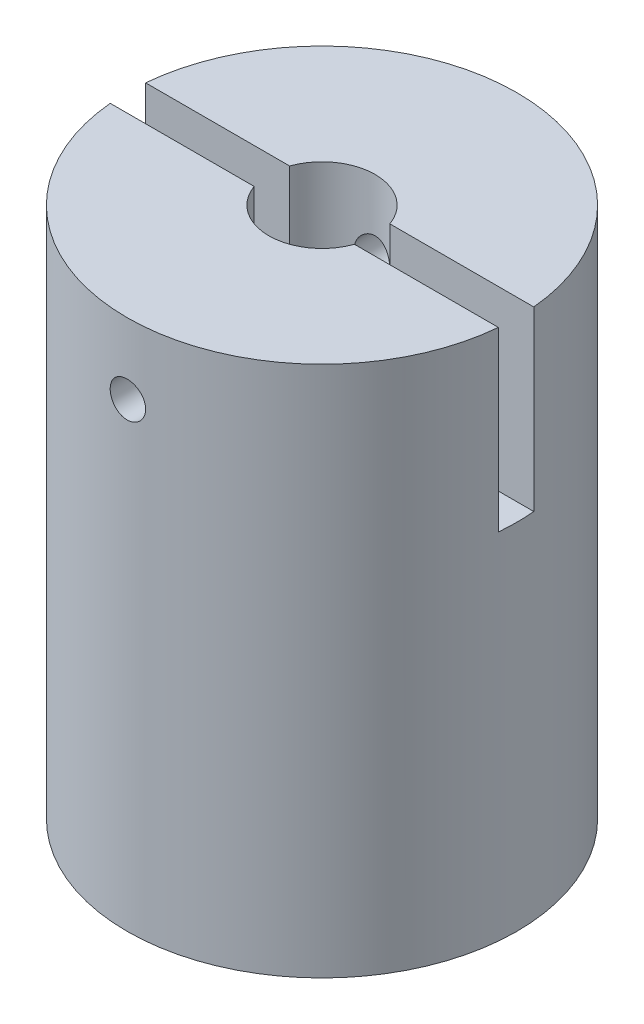
from build123d import *

# Parameters (mm, degrees)
SKIZZE1_R                            = 11
AUFSATZ_LINEAR_AUSTRAGEN1_DEPTH      = 30
SKIZZE2_R                            = 3
SCHNITT_LINEAR_AUSTRAGEN1_DEPTH      = 34.793490497
SKIZZE3_W                            = 30
SKIZZE3_H                            = 2
SCHNITT_LINEAR_AUSTRAGEN2_DEPTH      = 10
SCHNITT_LINEAR_AUSTRAGEN3_DEPTH      = 35.132096332
SCHNITT_LINEAR_AUSTRAGEN3_DEPTH_BACK = 35.132096332
SKIZZE4_R                            = 1
SKIZZE5_R                            = 1
SCHNITT_LINEAR_AUSTRAGEN4_DEPTH      = 10


with BuildPart() as part:
    # Skizze1 → Aufsatz-Linear austragen1 (new body)
    with BuildSketch(Plane(origin=(0, 0, 0), x_dir=(1, 0, 0), z_dir=(0, 1, 0))):
        with Locations(Location((0, 0, 0), (0, 0, 270))):
            Circle(SKIZZE1_R)
    extrude(amount=AUFSATZ_LINEAR_AUSTRAGEN1_DEPTH)

    # Skizze2 → Schnitt-Linear austragen1 (cut, through all)
    with BuildSketch(Plane(origin=(0, 30, 0), x_dir=(1, 0, 0), z_dir=(0, 1, 0))):
        with Locations(Location((0, 0, 0), (0, 0, 270))):
            Circle(SKIZZE2_R)
    extrude(amount=-SCHNITT_LINEAR_AUSTRAGEN1_DEPTH, mode=Mode.SUBTRACT)

    # Skizze3 → Schnitt-Linear austragen2 (cut)
    with BuildSketch(Plane(origin=(0, 30, 0), x_dir=(1, 0, 0), z_dir=(0, 1, 0))):
        Rectangle(SKIZZE3_W, SKIZZE3_H)
    extrude(amount=-SCHNITT_LINEAR_AUSTRAGEN2_DEPTH, mode=Mode.SUBTRACT)

    # Skizze4 → Schnitt-Linear austragen3 (cut, two sides: drawn at the far end of the back side and taken through both)
    with BuildSketch(Plane.XY.offset(-1).offset(-SCHNITT_LINEAR_AUSTRAGEN3_DEPTH_BACK)):
        with Locations((0, 26)):
            Circle(SKIZZE4_R)
    extrude(amount=SCHNITT_LINEAR_AUSTRAGEN3_DEPTH + SCHNITT_LINEAR_AUSTRAGEN3_DEPTH_BACK, mode=Mode.SUBTRACT)

    # Skizze5 → Schnitt-Linear austragen4 (cut)
    with BuildSketch(Plane.XZ):
        with Locations(Location((0, 7.5, 0), (0, 0, 270))):
            Circle(SKIZZE5_R)
        with Locations(Location((0, -7.5, 0), (0, 0, 270))):
            Circle(SKIZZE5_R)
    extrude(amount=-SCHNITT_LINEAR_AUSTRAGEN4_DEPTH, mode=Mode.SUBTRACT)


solid = part.part
